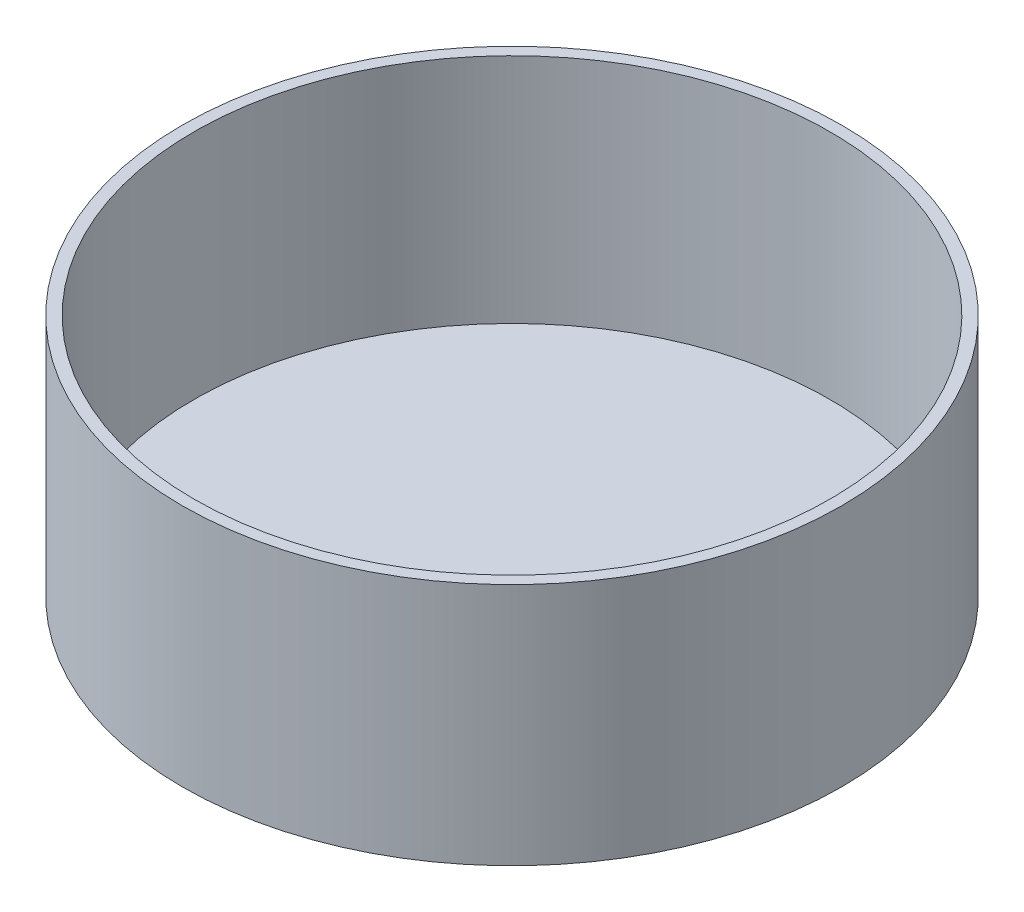
from build123d import *

# Parameters (mm, degrees)
SKETCH1_R           = 56.875
BOSS_EXTRUDE1_DEPTH = 2
SKETCH2_R           = 56.875
SKETCH2_R_2         = 54.875
BOSS_EXTRUDE2_DEPTH = 40


with BuildPart() as part:
    # Sketch1 → Boss-Extrude1 (new body)
    with BuildSketch(Plane(origin=(0, 0, 0), x_dir=(1, 0, 0), z_dir=(0, 1, 0))):
        with Locations(Location((0, 0, 0), (0, 0, 270))):
            Circle(SKETCH1_R)
    extrude(amount=BOSS_EXTRUDE1_DEPTH)

    # Sketch2 → Boss-Extrude2 (add)
    with BuildSketch(Plane(origin=(0, 2, 0), x_dir=(1, 0, 0), z_dir=(0, 1, 0))):
        with Locations(Location((0, 0, 0), (0, 0, 270))):
            Circle(SKETCH2_R)
        with Locations(Location((0, 0, 0), (0, 0, 270))):
            Circle(SKETCH2_R_2, mode=Mode.SUBTRACT)
    extrude(amount=BOSS_EXTRUDE2_DEPTH)


solid = part.part
